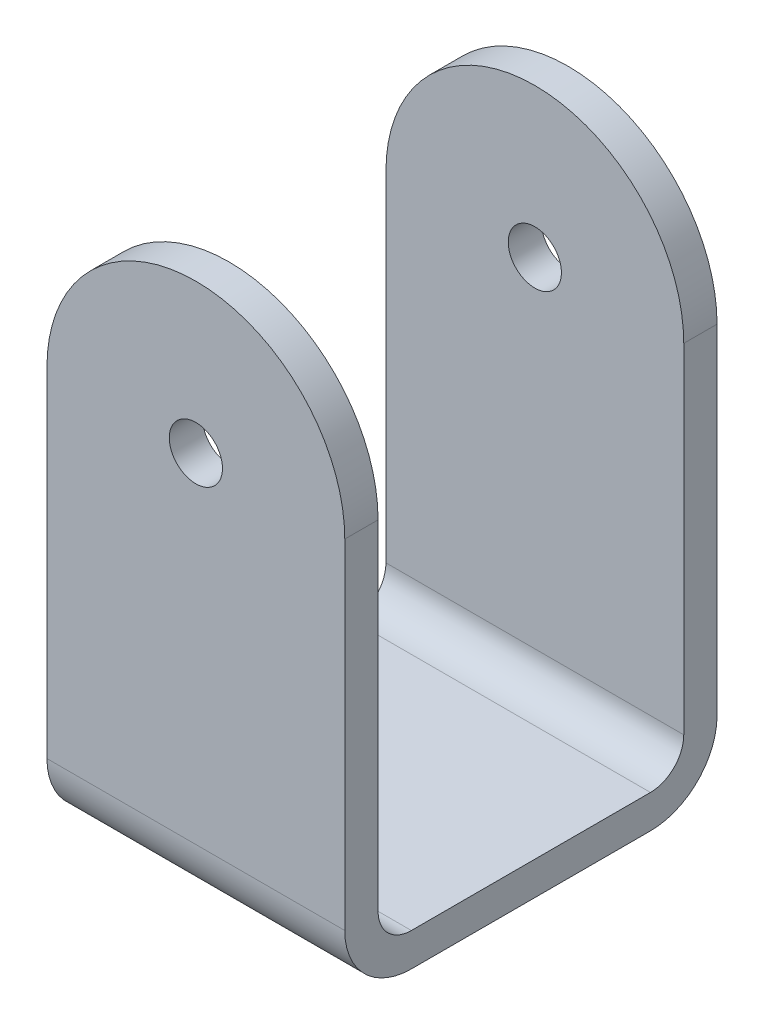
from build123d import *

# Parameters (mm, degrees)
SKETCH1_R           = 6.35
BOSS_EXTRUDE1_DEPTH = 44.45
CUT_EXTRUDE1_DEPTH  = 129.116424162
FILLET1_R           = 15.9004


with BuildPart() as part:
    # Sketch1 → Boss-Extrude1 (new, symmetric)
    with BuildSketch(Plane.XY):
        with BuildLine():
            Line((-35.56, 0), (-35.56, -96.8502))
            Line((-35.56, -96.8502), (35.56, -96.8502))
            Line((35.56, -96.8502), (35.56, 0))
            ThreePointArc((35.56, 0), (0, 35.56), (-35.56, 0))
        make_face()
        Circle(SKETCH1_R, mode=Mode.SUBTRACT)
    extrude(amount=BOSS_EXTRUDE1_DEPTH, both=True)

    # Sketch2 → Cut-Extrude1 (cut, through all)
    with BuildSketch(Plane(origin=(35.56, 0, 0), x_dir=(0, 0, -1), z_dir=(1, 0, 0))):
        with BuildLine():
            Line((-36.4998, 50.8), (36.4998, 50.8))
            Line((36.4998, 50.8), (36.4998, -80.9498))
            ThreePointArc((36.4998, -80.9498), (34.171240332, -86.571440332), (28.5496, -88.9))
            Line((28.5496, -88.9), (-28.5496, -88.9))
            ThreePointArc((-28.5496, -88.9), (-34.171240332, -86.571440332), (-36.4998, -80.9498))
            Line((-36.4998, -80.9498), (-36.4998, 50.8))
        make_face()
    extrude(amount=-CUT_EXTRUDE1_DEPTH, mode=Mode.SUBTRACT)

    # Fillet1
    fillet1_edges = [part.edges().sort_by_distance(p)[0] for p in [
        (0, -96.8502, 44.45),
        (0, -96.8502, -44.45),
    ]]
    fillet(fillet1_edges, radius=FILLET1_R)


solid = part.part
